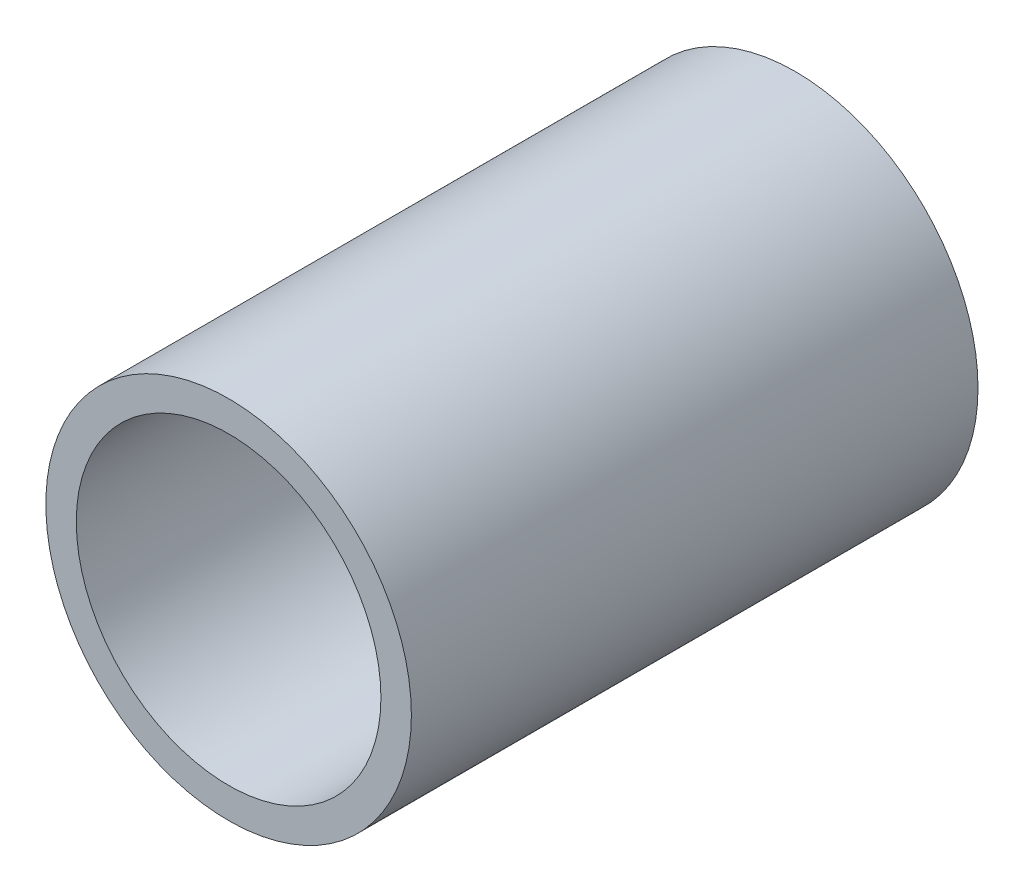
from build123d import *

# Parameters (mm, degrees)
SKETCH1_R           = 6
SKETCH1_R_2         = 5
BOSS_EXTRUDE1_DEPTH = 18.6012


with BuildPart() as part:
    # Sketch1 → Boss-Extrude1 (new body)
    with BuildSketch(Plane.XY):
        Circle(SKETCH1_R)
        Circle(SKETCH1_R_2, mode=Mode.SUBTRACT)
    extrude(amount=-BOSS_EXTRUDE1_DEPTH)


solid = part.part
